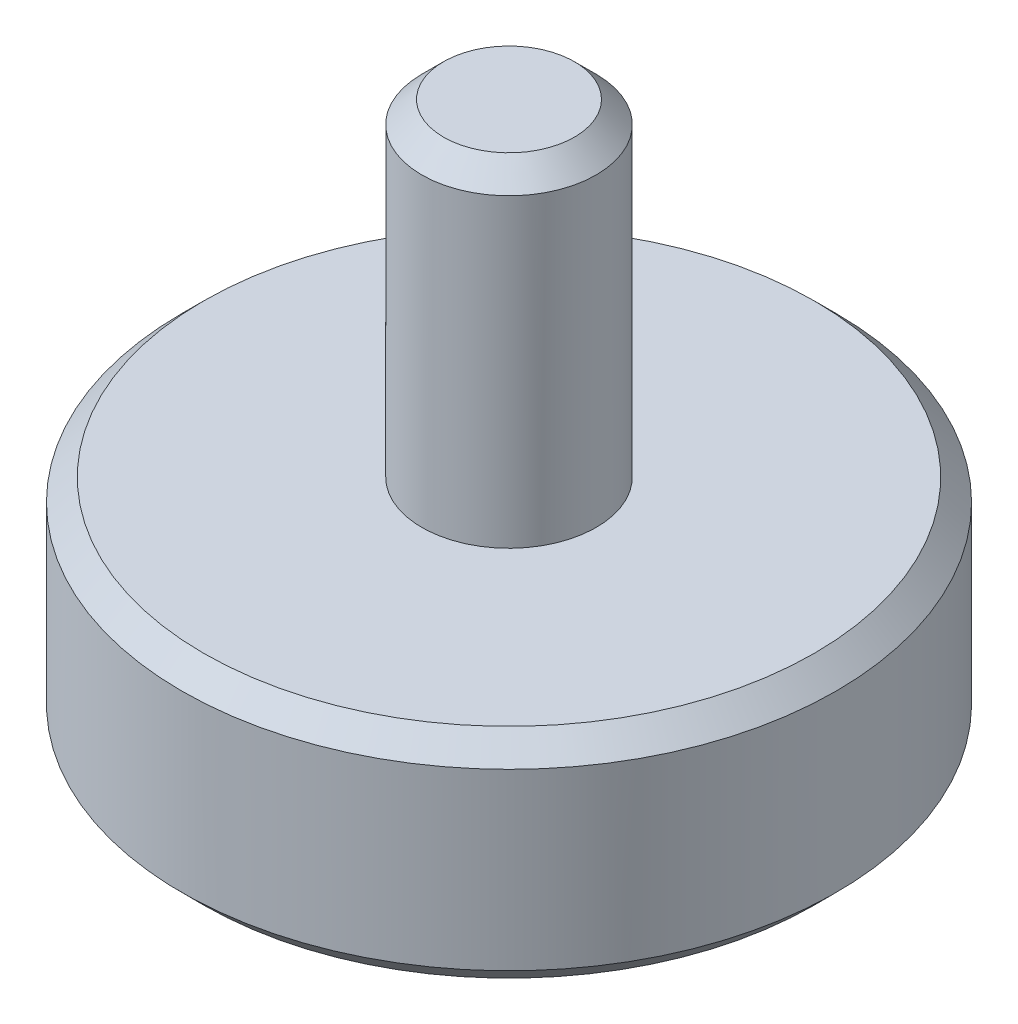
from build123d import *

# Parameters (mm, degrees)
CHAMFER_1_SIZE = 1


with BuildPart() as part:
    # Эскиз1 → Повернуть1 (revolve)
    with BuildSketch(Plane.XY, mode=Mode.PRIVATE) as revolve_1_sk:
        Polygon((0, 25), (4, 25), (4, 10), (15, 10), (15, 0), (0, 0), align=None)
    revolve(revolve_1_sk.sketch.rotate(Axis((0, 0, 0), (0, 1, 0)), 90), axis=Axis((0, 0, 0), (0, 1, 0)))

    # Фаска1
    chamfer_1_edges = [part.edges().sort_by_distance(p)[0] for p in [
        (0, 0, 15),
        (0, 10, 15),
        (0, 25, 4),
    ]]
    chamfer(chamfer_1_edges, length=CHAMFER_1_SIZE)


solid = part.part
